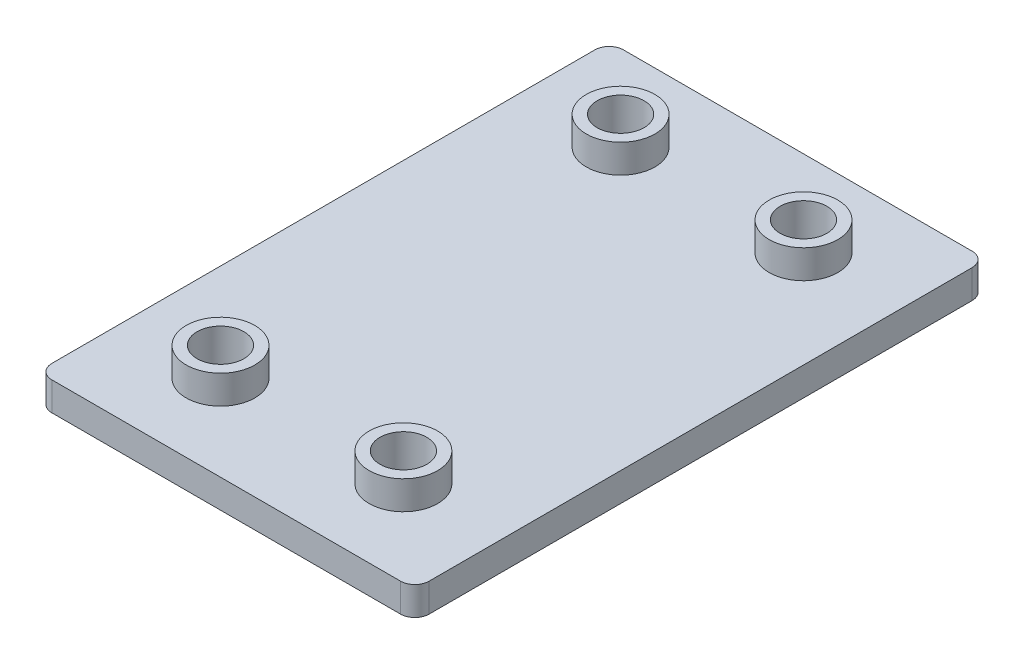
from build123d import *

# Parameters (mm, degrees)
SKETCH1_W                               = 66
SKETCH1_H                               = 100
BOSS_EXTRUDE1_DEPTH                     = 5
SKETCH2_R                               = 6
BOSS_EXTRUDE2_DEPTH                     = 5
CBORE_FOR_M5_HEX_HEAD_BOLT1_D           = 5
CBORE_FOR_M5_HEX_HEAD_BOLT1_CBORE_D     = 8.2
CBORE_FOR_M5_HEX_HEAD_BOLT1_CBORE_DEPTH = 8
FILLET1_R                               = 2.5


with BuildPart() as part:
    # Sketch1 → Boss-Extrude1 (new body)
    with BuildSketch(Plane(origin=(0, 0, 0), x_dir=(1, 0, 0), z_dir=(0, 1, 0))):
        Rectangle(SKETCH1_W, SKETCH1_H)
    extrude(amount=BOSS_EXTRUDE1_DEPTH)

    # Sketch2 → Boss-Extrude2 (add)
    with BuildSketch(Plane(origin=(0, 5, 0), x_dir=(1, 0, 0), z_dir=(0, 1, 0))):
        with Locations(Location((-16, 35, 0), (0, 0, 270))):
            Circle(SKETCH2_R)
        with Locations(Location((16, 35, 0), (0, 0, 90))):
            Circle(SKETCH2_R)
        with Locations(Location((16, -35, 0), (0, 0, 270))):
            Circle(SKETCH2_R)
        with Locations(Location((-16, -35, 0), (0, 0, 90))):
            Circle(SKETCH2_R)
    extrude(amount=BOSS_EXTRUDE2_DEPTH)

    # CBORE for M5 Hex Head Bolt1 (through all)
    with Locations(Plane(origin=(0, 10, 0), x_dir=(1, 0, 0), z_dir=(0, 1, 0))):
        with Locations((-16, 35), (16, 35), (16, -35), (-16, -35)):
            CounterBoreHole(CBORE_FOR_M5_HEX_HEAD_BOLT1_D / 2, CBORE_FOR_M5_HEX_HEAD_BOLT1_CBORE_D / 2, CBORE_FOR_M5_HEX_HEAD_BOLT1_CBORE_DEPTH)

    # Fillet1
    fillet1_edges = [part.edges().sort_by_distance(p)[0] for p in [
        (-33, 2.5, -50),
        (33, 2.5, -50),
        (33, 2.5, 50),
        (-33, 2.5, 50),
    ]]
    fillet(fillet1_edges, radius=FILLET1_R)


solid = part.part
